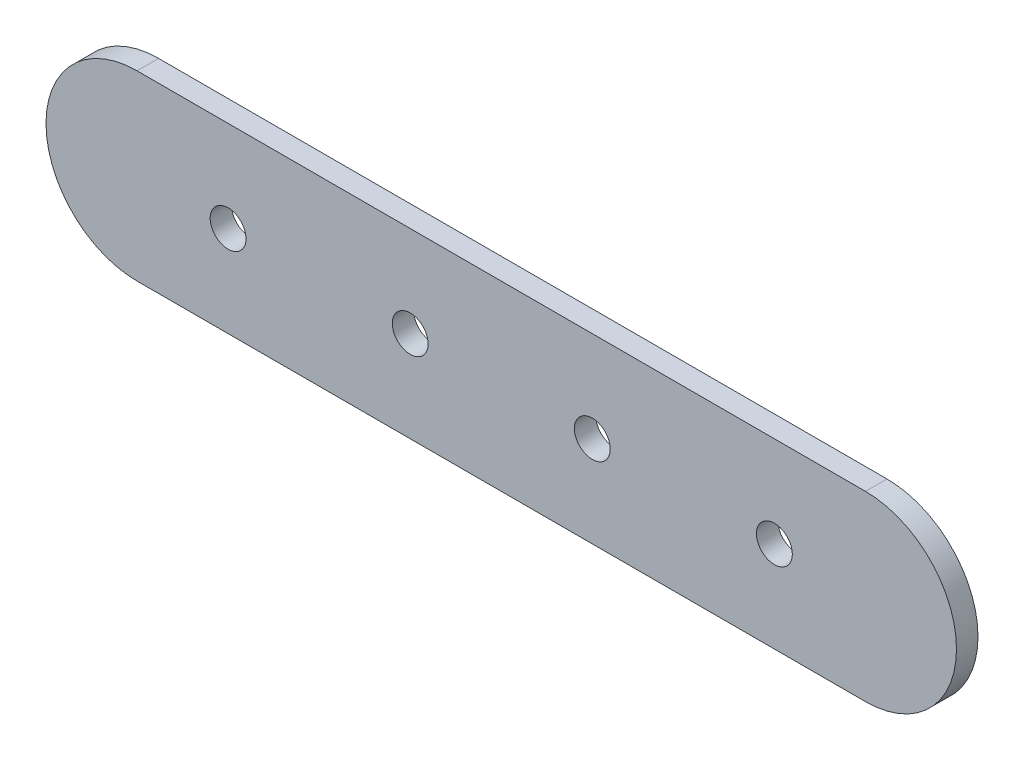
from build123d import *

# Parameters (mm, degrees)
SKETCH1_R           = 25
BOSS_EXTRUDE1_DEPTH = 30


with BuildPart() as part:
    # Sketch1 → Boss-Extrude1 (new body)
    with BuildSketch(Plane.XY):
        with BuildLine():
            Line((-494.678321678, 127), (521.321678322, 127))
            ThreePointArc((521.321678322, 127), (648.321678322, 0), (521.321678322, -127))
            Line((521.321678322, -127), (-494.678321678, -127))
            ThreePointArc((-494.678321678, -127), (-621.678321678, 0), (-494.678321678, 127))
        make_face()
        with Locations((-367.678321678, 0)):
            Circle(SKETCH1_R, mode=Mode.SUBTRACT)
        with Locations((-113.678321678, 0)):
            Circle(SKETCH1_R, mode=Mode.SUBTRACT)
        with Locations((140.321678322, 0)):
            Circle(SKETCH1_R, mode=Mode.SUBTRACT)
        with Locations((394.321678322, 0)):
            Circle(SKETCH1_R, mode=Mode.SUBTRACT)
    extrude(amount=BOSS_EXTRUDE1_DEPTH)


solid = part.part
